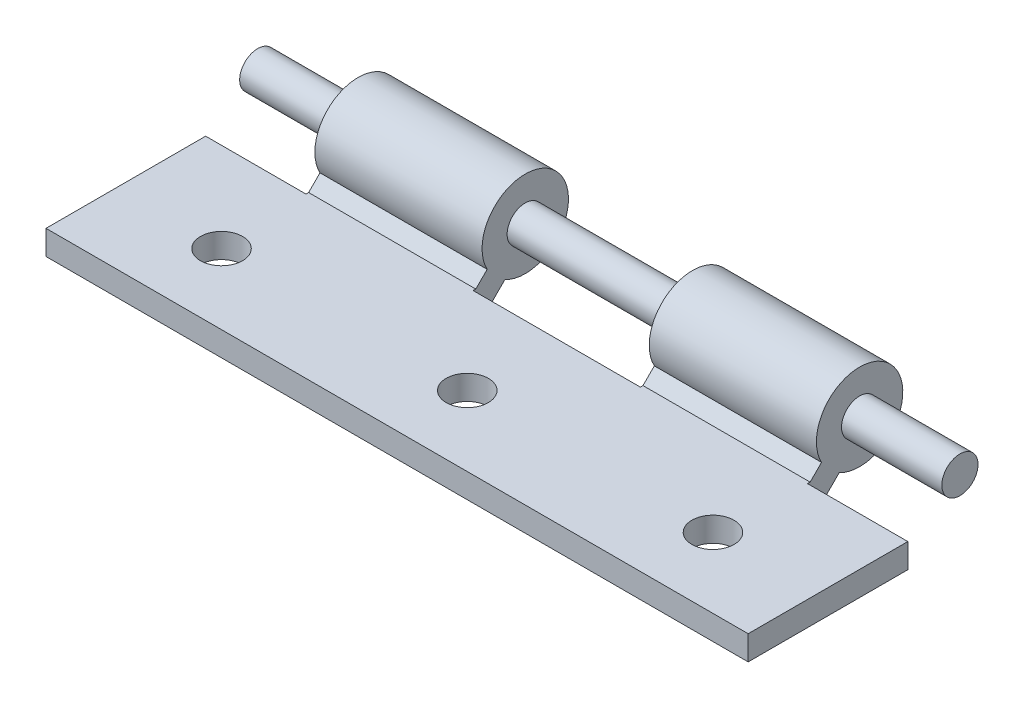
from build123d import *

# Parameters (mm, degrees)
SKETCH1_R               = 2.5796875
LEFT_LEAF_DEPTH         = 50.00625
CUT_EXTRUDE1_DEPTH      = 59.94405352
CUT_EXTRUDE1_DEPTH_BACK = 59.94405352
SKETCH2_W               = 14.2875
SKETCH2_H               = 13.573125
SKETCH2_W_2             = 23.8125
SKETCH10_R              = 2.5796875
EXTRUDE1_DEPTH          = 50.00625
SKETCH11_R              = 3
CUT_EXTRUDE2_DEPTH      = 10


with BuildPart() as part:
    # Sketch1 → Left Leaf (new, symmetric)
    with BuildSketch(Plane(origin=(0, 0, 0), x_dir=(0, 0, -1), z_dir=(1, 0, 0))):
        with BuildLine():
            Line((-5.474302966, -8), (-2.899611599, -5.425308633))
            ThreePointArc((-2.899611599, -5.425308633), (4.349811559, 4.349811559), (-5.425308633, -2.899611599))
            Line((-5.425308633, -2.899611599), (-7.045897034, -4.5202))
            Line((-7.045897034, -4.5202), (-30.1625, -4.5202))
            Line((-30.1625, -4.5202), (-30.1625, -8))
            Line((-30.1625, -8), (-5.474302966, -8))
        make_face()
        with Locations(Location((0, 0, 0), (0, 0, 180))):
            Circle(SKETCH1_R, mode=Mode.SUBTRACT)
    extrude(amount=LEFT_LEAF_DEPTH, both=True)

    # Sketch2 → Cut-Extrude1 (cut, two sides: drawn at the far end of the back side and taken through both)
    with BuildSketch(Plane(origin=(0, 0, 0), x_dir=(1, 0, 0), z_dir=(0, 1, 0)).offset(-CUT_EXTRUDE1_DEPTH_BACK)):
        with Locations((42.8625, -0.635)):
            Rectangle(SKETCH2_W, SKETCH2_H)
        with Locations((-42.8625, -0.635)):
            Rectangle(SKETCH2_W, SKETCH2_H)
        with Locations((0, -0.635)):
            Rectangle(SKETCH2_W_2, SKETCH2_H)
    extrude(amount=CUT_EXTRUDE1_DEPTH + CUT_EXTRUDE1_DEPTH_BACK, mode=Mode.SUBTRACT)

    # Sketch11 → Cut-Extrude2 (cut)
    with BuildSketch(Plane(origin=(0, -4.5202, 0), x_dir=(1, 0, 0), z_dir=(0, 1, 0))):
        with Locations(Location((-35.00625, -20.1625, 0), (0, 0, 270))):
            Circle(SKETCH11_R)
        with Locations(Location((-0.00625, -20.1625, 0), (0, 0, 270))):
            Circle(SKETCH11_R)
        with Locations(Location((34.99375, -20.1625, 0), (0, 0, 270))):
            Circle(SKETCH11_R)
    extrude(amount=-CUT_EXTRUDE2_DEPTH, mode=Mode.SUBTRACT)


with BuildPart() as body_2:
    # Sketch10 → Extrude1 (new, symmetric)
    with BuildSketch(Plane(origin=(0, 0, 0), x_dir=(0, 0, -1), z_dir=(1, 0, 0))):
        with Locations(Location((0, 0, 0), (0, 0, 180))):
            Circle(SKETCH10_R)
    extrude(amount=EXTRUDE1_DEPTH, both=True)


solid = Compound([part.part, body_2.part])
